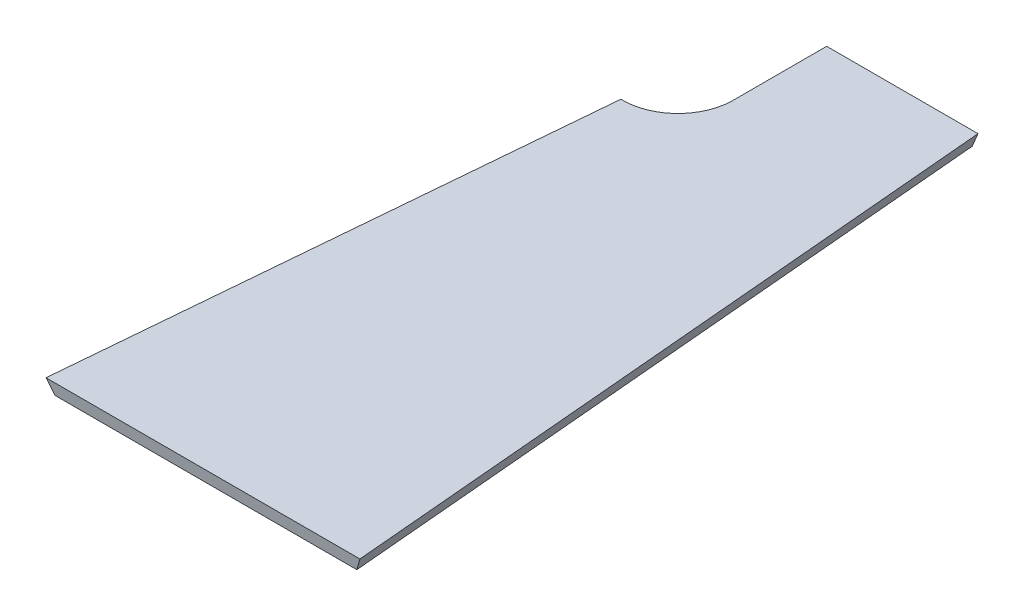
from build123d import *

# Parameters (mm, degrees)
SKIZZE1_W                            = 57
SKIZZE1_H                            = 123
AUFSATZ_LINEAR_AUSTRAGEN1_DEPTH      = 2.5
SCHNITT_LINEAR_AUSTRAGEN1_DEPTH      = 84.889808678
SCHNITT_LINEAR_AUSTRAGEN2_DEPTH      = 68.828828679
SCHNITT_LINEAR_AUSTRAGEN3_DEPTH      = 70.726045338
SCHNITT_LINEAR_AUSTRAGEN3_DEPTH_BACK = 70.726045338
SCHNITT_LINEAR_AUSTRAGEN4_DEPTH      = 70.47454308
SCHNITT_LINEAR_AUSTRAGEN4_DEPTH_BACK = 70.47454308
SCHNITT_LINEAR_AUSTRAGEN5_DEPTH      = 68.828828679


with BuildPart() as part:
    # Skizze1 → Aufsatz-Linear austragen1 (new body)
    with BuildSketch(Plane(origin=(0, 0, 0), x_dir=(1, 0, 0), z_dir=(0, 1, 0))):
        Rectangle(SKIZZE1_W, SKIZZE1_H)
    extrude(amount=AUFSATZ_LINEAR_AUSTRAGEN1_DEPTH)

    # Skizze2 → Schnitt-Linear austragen1 (cut, through all)
    with BuildSketch(Plane(origin=(28.5, 0, 0), x_dir=(0, 0, -1), z_dir=(1, 0, 0))):
        Polygon((-61.5, 2.5), (-61.5, 0), (-60.968608596, 0), align=None)
    extrude(amount=-SCHNITT_LINEAR_AUSTRAGEN1_DEPTH, mode=Mode.SUBTRACT)

    # Skizze3 → Schnitt-Linear austragen2 (cut, through all)
    with BuildSketch(Plane(origin=(0, 2.5, 0), x_dir=(1, 0, 0), z_dir=(0, 1, 0))):
        Polygon((-28.5, -61.5), (-17.738894386, 61.5), (-28.5, 61.5), align=None)
        Polygon((28.5, -61.5), (17.738894386, 61.5), (28.5, 61.5), align=None)
    extrude(amount=-SCHNITT_LINEAR_AUSTRAGEN2_DEPTH, mode=Mode.SUBTRACT)

    # Skizze5 → Schnitt-Linear austragen3 (cut, two sides: drawn at the far end of the back side and taken through both)
    with BuildSketch(Plane(origin=(0.175618176, 0, 2.007324937), x_dir=(0, -1, 0), z_dir=(0.08715574274765484, 0, 0.9961946980917459)).offset(-SCHNITT_LINEAR_AUSTRAGEN3_DEPTH_BACK)):
        Polygon((0.008562414, 23.031470717), (-2.5, 23.031470717), (0, 21.995936811), align=None)
    extrude(amount=SCHNITT_LINEAR_AUSTRAGEN3_DEPTH + SCHNITT_LINEAR_AUSTRAGEN3_DEPTH_BACK, mode=Mode.SUBTRACT)

    # Skizze6 → Schnitt-Linear austragen4 (cut, two sides: drawn at the far end of the back side and taken through both)
    with BuildSketch(Plane(origin=(-0.152372814, 0, 1.741629235), x_dir=(0, 1, 0), z_dir=(-0.08715574274766175, 0, 0.9961946980917452)).offset(-SCHNITT_LINEAR_AUSTRAGEN4_DEPTH_BACK)):
        Polygon((2.5, 23.031470717), (0, 21.995936811), (0, 23.031470717), align=None)
    extrude(amount=SCHNITT_LINEAR_AUSTRAGEN4_DEPTH + SCHNITT_LINEAR_AUSTRAGEN4_DEPTH_BACK, mode=Mode.SUBTRACT)

    # Skizze7 → Schnitt-Linear austragen5 (cut, through all)
    with BuildSketch(Plane(origin=(0, 2.5, 0), x_dir=(1, 0, 0), z_dir=(0, 1, 0))):
        with BuildLine():
            Line((-9.738894386, 61.5), (-9.738894386, 44.5))
            ThreePointArc((-9.738894386, 44.5), (-12.667826574, 37.428932188), (-19.738894386, 34.5))
            Line((-19.738894386, 34.5), (-20.101088302, 34.5))
            Line((-20.101088302, 34.5), (-17.738894386, 61.5))
            Line((-17.738894386, 61.5), (-9.738894386, 61.5))
        make_face()
    extrude(amount=-SCHNITT_LINEAR_AUSTRAGEN5_DEPTH, mode=Mode.SUBTRACT)


solid = part.part
